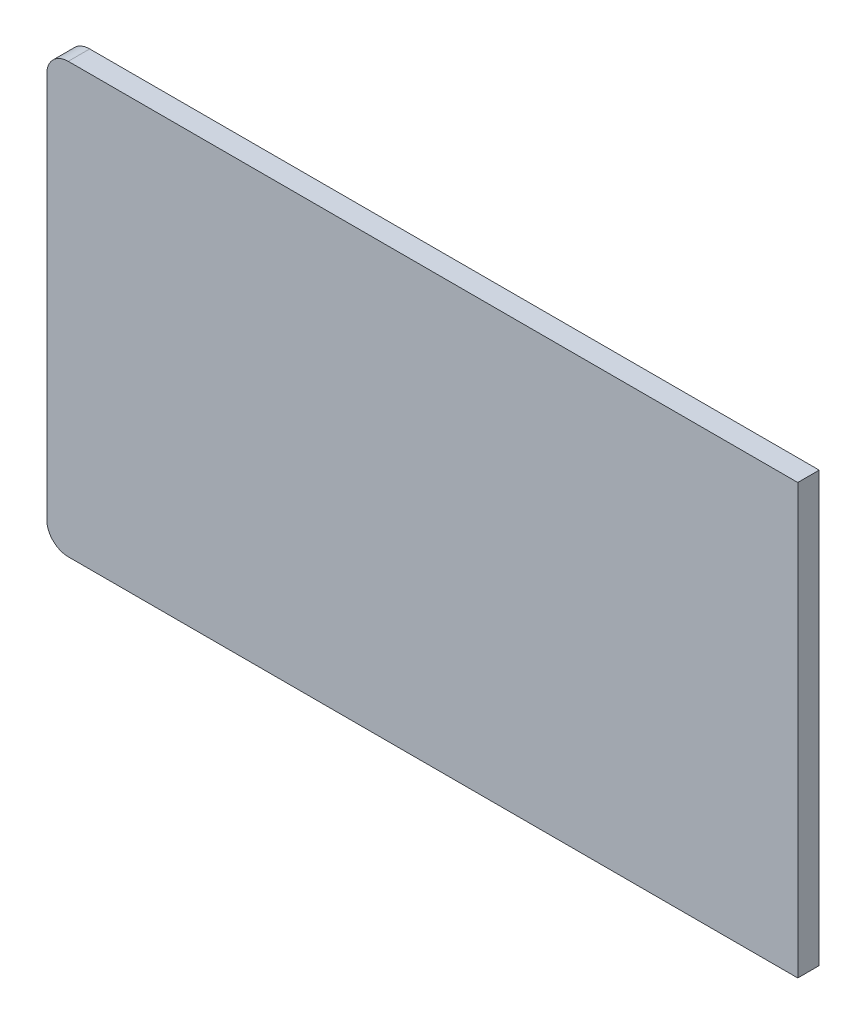
from build123d import *

# Parameters (mm, degrees)
BOSS_EXTRU_1_DEPTH = 2


with BuildPart() as part:
    # Esquisse1 → Boss.-Extru.1 (new body)
    with BuildSketch(Plane.XY):
        with BuildLine():
            Line((35, -20), (-33, -20))
            ThreePointArc((-33, -20), (-34.414213562, -19.414213562), (-35, -18))
            Line((-35, -18), (-35, 18))
            ThreePointArc((-35, 18), (-34.414213562, 19.414213562), (-33, 20))
            Line((-33, 20), (35, 20))
            Line((35, 20), (35, -20))
        make_face()
    extrude(amount=BOSS_EXTRU_1_DEPTH)


solid = part.part
